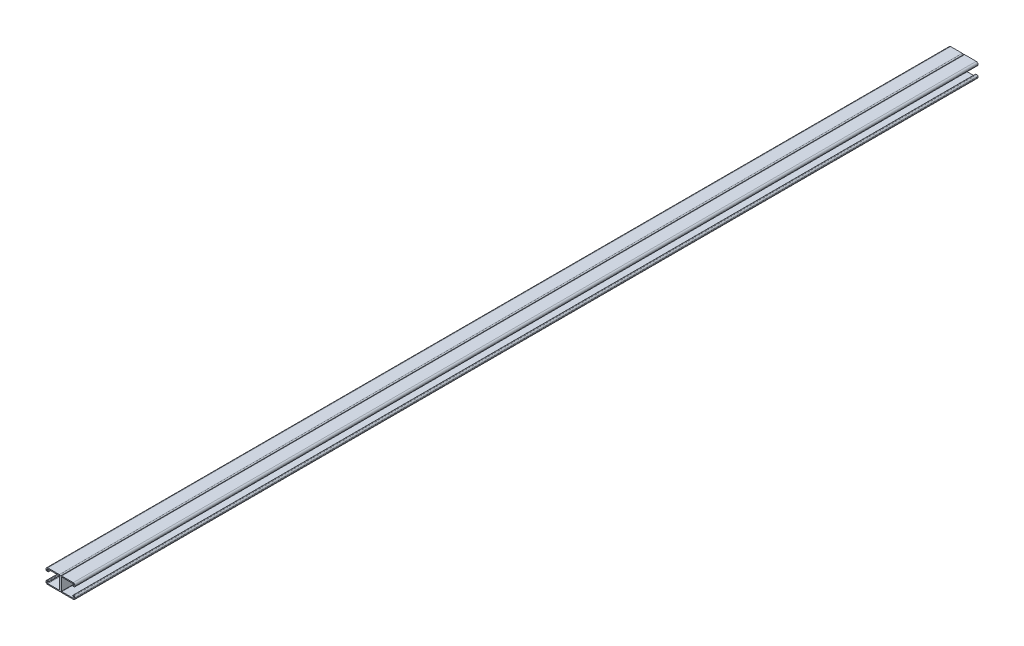
from build123d import *

# Parameters (mm, degrees)
BOSS_EXTRUDE1_DEPTH = 3048
SKETCH4_W           = 82.55
SKETCH4_H           = 485.775
CUT_EXTRUDE1_DEPTH  = 3049.558881053


with BuildPart() as part:
    # Sketch1 → Boss-Extrude1 (new body)
    with BuildSketch(Plane.XY):
        with BuildLine():
            Line((-36.22675, 20.6375), (-3.46075, 20.6375))
            ThreePointArc((-3.46075, 20.6375), (-1.013630207, 19.623869793), (0, 17.17675))
            Line((0, 17.17675), (0, -17.17675))
            ThreePointArc((0, -17.17675), (-1.013630207, -19.623869793), (-3.46075, -20.6375))
            Line((-3.46075, -20.6375), (-36.22675, -20.6375))
            ThreePointArc((-36.22675, -20.6375), (-39.796401808, -19.158901808), (-41.275, -15.58925))
            Line((-41.275, -15.58925), (-41.275, -14.57325))
            ThreePointArc((-41.275, -14.57325), (-40.261369793, -12.126130207), (-37.81425, -11.1125))
            Line((-37.81425, -11.1125), (-35.5346, -11.1125))
            ThreePointArc((-35.5346, -11.1125), (-34.1376, -12.5095), (-35.5346, -13.9065))
            Line((-35.5346, -13.9065), (-37.81425, -13.9065))
            ThreePointArc((-37.81425, -13.9065), (-38.285713446, -14.101786554), (-38.481, -14.57325))
            Line((-38.481, -14.57325), (-38.481, -15.58925))
            ThreePointArc((-38.481, -15.58925), (-37.820745461, -17.183245461), (-36.22675, -17.8435))
            Line((-36.22675, -17.8435), (-3.46075, -17.8435))
            ThreePointArc((-3.46075, -17.8435), (-2.989286554, -17.648213446), (-2.794, -17.17675))
            Line((-2.794, -17.17675), (-2.794, 17.17675))
            ThreePointArc((-2.794, 17.17675), (-2.989286554, 17.648213446), (-3.46075, 17.8435))
            Line((-3.46075, 17.8435), (-36.22675, 17.8435))
            ThreePointArc((-36.22675, 17.8435), (-37.820745461, 17.183245461), (-38.481, 15.58925))
            Line((-38.481, 15.58925), (-38.481, 14.57325))
            ThreePointArc((-38.481, 14.57325), (-38.285713446, 14.101786554), (-37.81425, 13.9065))
            Line((-37.81425, 13.9065), (-35.5346, 13.9065))
            ThreePointArc((-35.5346, 13.9065), (-34.1376, 12.5095), (-35.5346, 11.1125))
            Line((-35.5346, 11.1125), (-37.81425, 11.1125))
            ThreePointArc((-37.81425, 11.1125), (-40.261369793, 12.126130207), (-41.275, 14.57325))
            Line((-41.275, 14.57325), (-41.275, 15.58925))
            ThreePointArc((-41.275, 15.58925), (-39.796401808, 19.158901808), (-36.22675, 20.6375))
        make_face()
    extrude(amount=-BOSS_EXTRUDE1_DEPTH)


with BuildPart() as body_2:
    # Mirror1: mirrored copy
    add(part.part.mirror(Plane(origin=(0, 17.17675, -3048), x_dir=(0, 0, 1), z_dir=(1, 0, 0))))


with BuildPart() as cut_extrude1_tool:
    # Sketch4 → Cut-Extrude1 (new, through all)
    with BuildSketch(Plane.XZ.offset(20.6375)):
        with Locations((0, -242.8875)):
            Rectangle(SKETCH4_W, SKETCH4_H)
    extrude(amount=-CUT_EXTRUDE1_DEPTH)


with BuildPart() as part_1:
    add(part.part)

    # Cut-Extrude1: cut by cut_extrude1_tool
    add(cut_extrude1_tool.part, mode=Mode.SUBTRACT)


with BuildPart() as body_2_1:
    add(body_2.part)

    # Cut-Extrude1: cut by cut_extrude1_tool
    add(cut_extrude1_tool.part, mode=Mode.SUBTRACT)

    # Combine1: union part
    add(part_1.part)


solid = body_2_1.part
